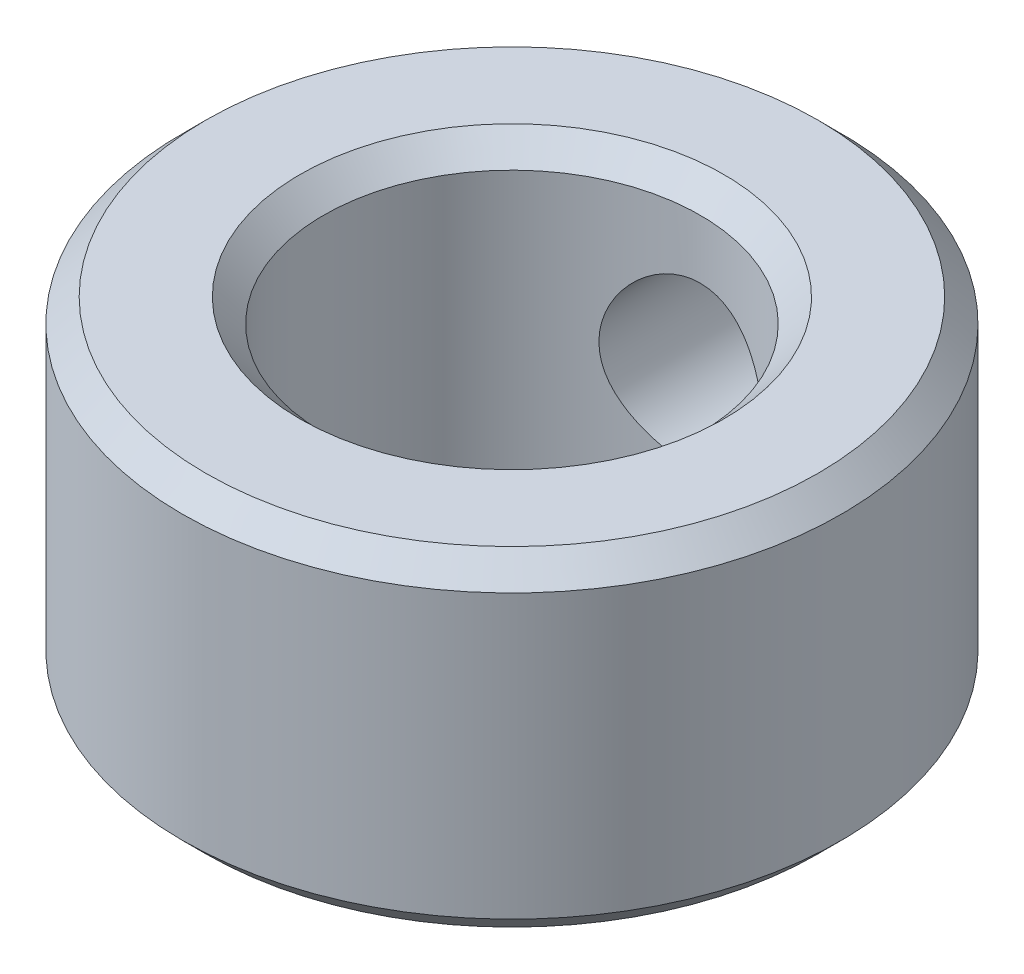
from build123d import *

# Parameters (mm, degrees)
SKETCH1_R               = 7
SKETCH1_R_2             = 4
BOSS_EXTRUDE1_DEPTH     = 7
CUT_EXTRUDE1_REACH      = 14.124
CUT_EXTRUDE1_END_RADIUS = 7
SKETCH2_R               = 1.75
CHAMFER1_SIZE           = 0.5


with BuildPart() as part:
    # Sketch1 → Boss-Extrude1 (new body)
    with BuildSketch(Plane(origin=(0, 0, 0), x_dir=(1, 0, 0), z_dir=(0, 1, 0))):
        with Locations(Location((0, 0, 0), (0, 0, 270))):
            Circle(SKETCH1_R)
        with Locations(Location((0, 0, 0), (0, 0, 270))):
            Circle(SKETCH1_R_2, mode=Mode.SUBTRACT)
    extrude(amount=BOSS_EXTRUDE1_DEPTH)

    # Cut-Extrude1: up to this cylinder (the profile starts inside it)
    cut_extrude1_end = Plane(origin=(0, 3.5, 0), z_dir=(0, -1, 0)) * Cylinder(CUT_EXTRUDE1_END_RADIUS, 43.248, mode=Mode.PRIVATE)
    # Sketch2 → Cut-Extrude1 (cut, up to the surface)
    with BuildSketch(Plane.XY, mode=Mode.PRIVATE) as cut_extrude1_sk1:
        with Locations((0, 3.5)):
            Circle(SKETCH2_R)
    cut_extrude1_tool1 = extrude(cut_extrude1_sk1.sketch, amount=-CUT_EXTRUDE1_REACH, mode=Mode.PRIVATE) & cut_extrude1_end
    add(cut_extrude1_tool1.solids().sort_by_distance((0, 3.5, 0))[0], mode=Mode.SUBTRACT)

    # Chamfer1
    chamfer1_edges = [part.edges().sort_by_distance(p)[0] for p in [
        (0, 0, -7),
        (0, 7, -7),
        (0, 0, -4),
        (0, 7, -4),
    ]]
    chamfer(chamfer1_edges, length=CHAMFER1_SIZE)


solid = part.part
